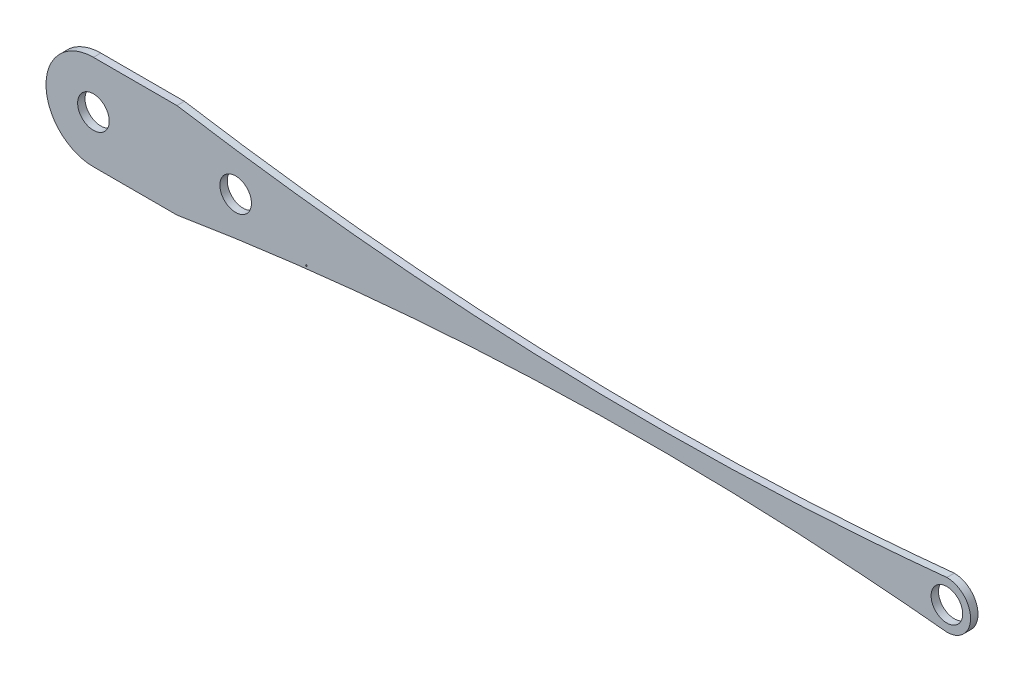
from build123d import *

# Parameters (mm, degrees)
SKETCH4_R               = 8.466666667
BOSS_EXTRUDE2_DEPTH     = 3.96875
SCALE1_SCALE            = 0.75
CUT_EXTRUDE1_DEPTH      = 393.277306545
CUT_EXTRUDE1_DEPTH_BACK = 393.277306545
SKETCH5_R               = 0.28575


with BuildPart() as part:
    # Sketch4 → Boss-Extrude2 (new body)
    with BuildSketch(Plane.XY):
        with BuildLine():
            Line((0, 25.4), (44.742290553, 25.4))
            add(Edge.make_bspline(
                [(44.742290553, 25.4), (249.949853312, -8.0006761), (457.2, 12.7)],
                knots=[0, 0, 0, 1, 1, 1], degree=2))
            ThreePointArc((457.2, 12.7), (469.9, 0), (457.2, -12.7))
            add(Edge.make_bspline(
                [(44.742290553, -25.4), (249.949853312, 8.0006761), (457.2, -12.7)],
                knots=[0, 0, 0, 1, 1, 1], degree=2))
            Line((44.742290553, -25.4), (0, -25.4))
            ThreePointArc((0, -25.4), (-25.4, 0), (0, 25.4))
        make_face()
        Circle(SKETCH4_R, mode=Mode.SUBTRACT)
        with Locations((76.2, 0)):
            Circle(SKETCH4_R, mode=Mode.SUBTRACT)
        with Locations((457.2, 0)):
            Circle(SKETCH4_R, mode=Mode.SUBTRACT)
    extrude(amount=BOSS_EXTRUDE2_DEPTH)


with BuildPart() as part_1:
    # Scale1: scaled about (157.512673369, 0, 1.984375)
    add(part.part.scale(SCALE1_SCALE).moved(Location((39.378168342, 0, 0.49609375))))

    # Sketch5 → Cut-Extrude1 (cut, two sides: drawn at the far end of the back side and taken through both)
    with BuildSketch(Plane.XY.offset(3.47265625).offset(-CUT_EXTRUDE1_DEPTH_BACK)):
        with Locations((124.940154128, -10.64454761)):
            Circle(SKETCH5_R)
    extrude(amount=CUT_EXTRUDE1_DEPTH + CUT_EXTRUDE1_DEPTH_BACK, mode=Mode.SUBTRACT)


solid = part_1.part
